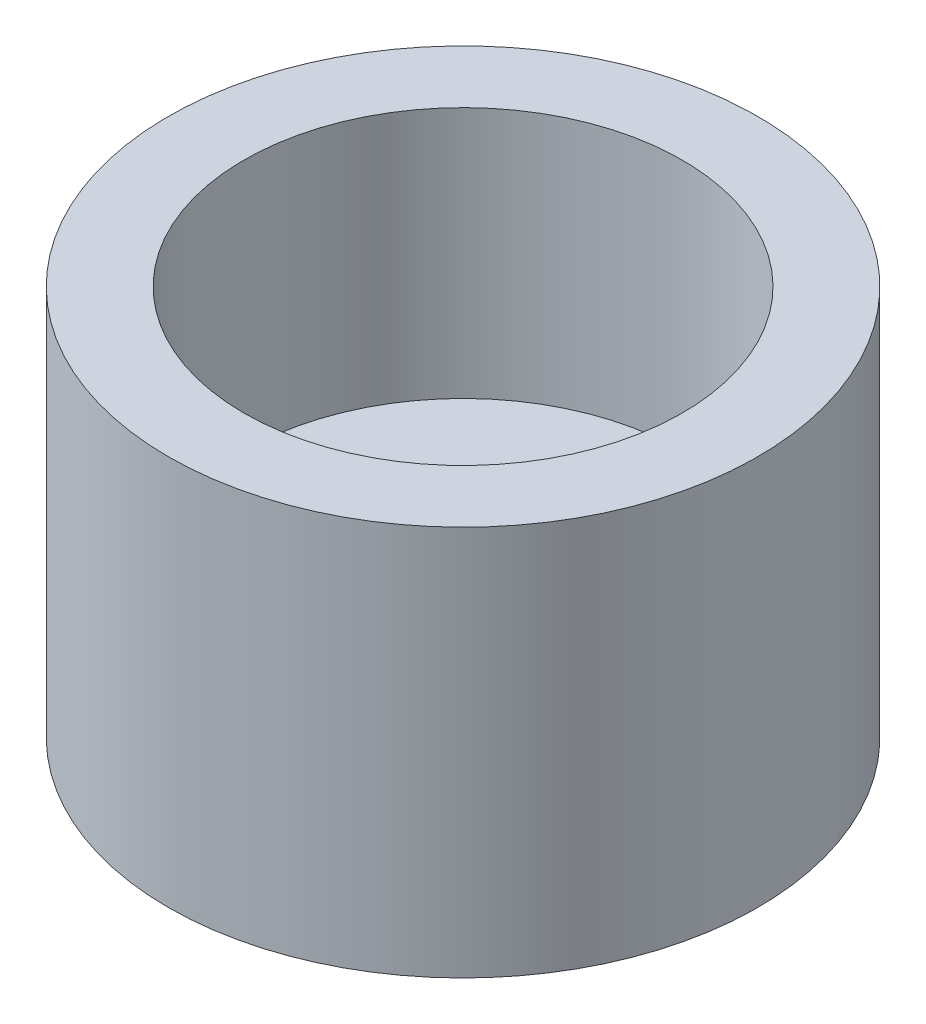
from build123d import *


with BuildPart() as part:
    # Sketch1 → Revolve-Thin1 (revolve)
    with BuildSketch(Plane.XY, mode=Mode.PRIVATE) as revolve_thin1_sk:
        Polygon((249.083870968, 39.738709677), (249.083870968, -265.061290323), (884.083870968, -265.061290323), (884.083870968, -519.061290323), (1188.883870968, -519.061290323), (1188.883870968, 1055.738709677), (884.083870968, 1055.738709677), (884.083870968, 39.738709677), align=None)
        Polygon((274.483870968, 14.338709677), (274.483870968, -239.661290323), (909.483870968, -239.661290323), (909.483870968, -493.661290323), (1163.483870968, -493.661290323), (1163.483870968, 1030.338709677), (909.483870968, 1030.338709677), (909.483870968, 14.338709677), align=None, mode=Mode.SUBTRACT)
    revolve(revolve_thin1_sk.sketch.rotate(Axis((0, 989.370967742, 0), (0, -1, 0)), 90), axis=Axis((0, 989.370967742, 0), (0, -1, 0)))


solid = part.part
